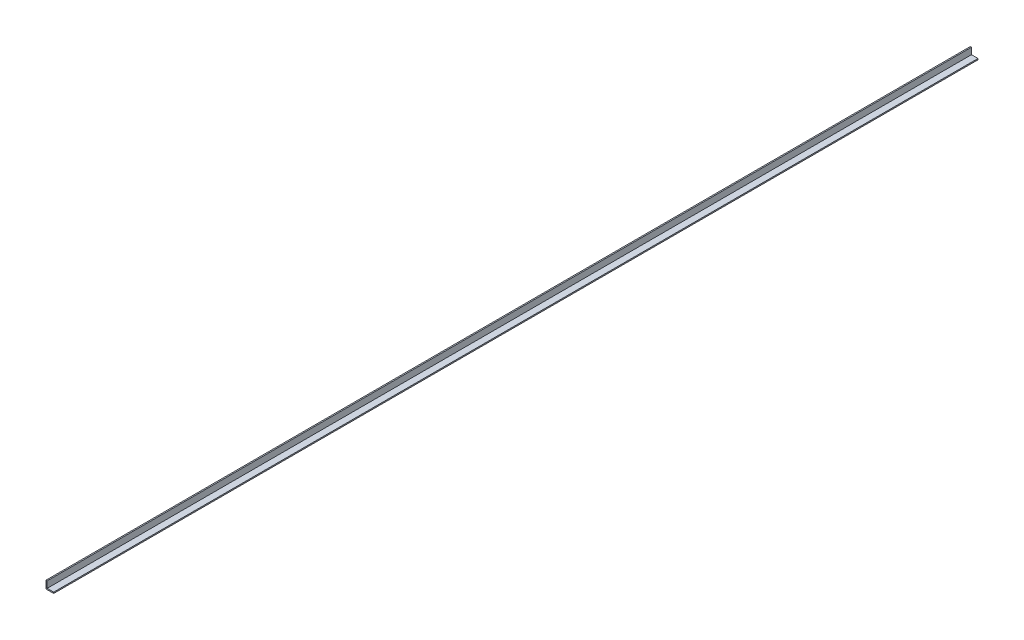
from build123d import *

# Parameters (mm, degrees)
SALIENTE_EXTRUIR1_DEPTH = 6100


with BuildPart() as part:
    # Croquis1 → Saliente-Extruir1 (new body)
    with BuildSketch(Plane.XY):
        Polygon((0, 50.8), (0, 0), (50.8, 0), (50.8, 7.94), (7.94, 7.94), (7.94, 50.8), align=None)
    extrude(amount=-SALIENTE_EXTRUIR1_DEPTH)


solid = part.part
